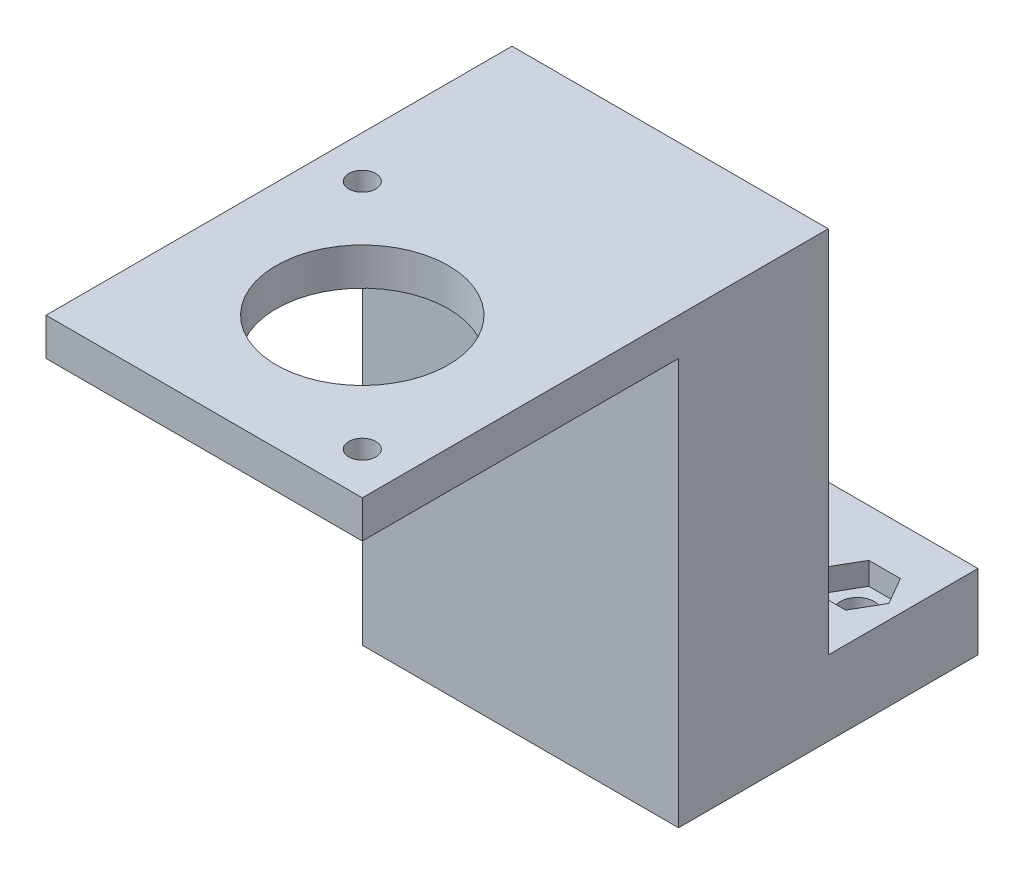
from build123d import *

# Parameters (mm, degrees)
BOSS_EXTRUDE1_DEPTH = 42.25
SKETCH3_R           = 2.25
CUT_EXTRUDE1_DEPTH  = 78.46363663
SKETCH4_R           = 11.5
SKETCH4_R_2         = 1.8
CUT_EXTRUDE2_DEPTH  = 81.737940276
SKETCH5_R           = 1.75
CUT_EXTRUDE3_DEPTH  = 96.794650164
CUT_EXTRUDE4_DEPTH  = 5
CUT_EXTRUDE5_DEPTH  = 3


with BuildPart() as part:
    # Sketch1 → Boss-Extrude1 (new body)
    with BuildSketch(Plane(origin=(0, 0, 0), x_dir=(0, 0, -1), z_dir=(1, 0, 0))):
        Polygon((0, 0), (40, 0), (40, 10), (20, 10), (20, 59.3), (-42.25, 59.3), (-42.25, 54.3), (0, 54.3), align=None)
    extrude(amount=BOSS_EXTRUDE1_DEPTH)

    # Sketch3 → Cut-Extrude1 (cut, through all)
    with BuildSketch(Plane(origin=(0, 10, 0), x_dir=(1, 0, 0), z_dir=(0, 1, 0))):
        with Locations(Location((6.125, 30, 0), (0, 0, 270))):
            Circle(SKETCH3_R)
        with Locations(Location((36.125, 30, 0), (0, 0, 270))):
            Circle(SKETCH3_R)
    extrude(amount=-CUT_EXTRUDE1_DEPTH, mode=Mode.SUBTRACT)

    # Sketch4 → Cut-Extrude2 (cut, through all)
    with BuildSketch(Plane.XZ.offset(-54.3)):
        with Locations(Location((21.125, 21.125, 0), (0, 0, 270))):
            Circle(SKETCH4_R)
        with Locations(Location((5.625, 5.625, 0), (0, 0, 270))):
            Circle(SKETCH4_R_2)
        with Locations(Location((36.625, 36.625, 0), (0, 0, 270))):
            Circle(SKETCH4_R_2)
    extrude(amount=-CUT_EXTRUDE2_DEPTH, mode=Mode.SUBTRACT)

    # Sketch5 → Cut-Extrude3 (cut, through all)
    with BuildSketch(Plane(origin=(0, 0, -20), x_dir=(-1, 0, 0), z_dir=(0, 0, -1))):
        with Locations(Location((-21.125, 43.6, 0), (0, 0, 90))):
            Circle(SKETCH5_R)
        with Locations(Location((-21.125, 37.6, 0), (0, 0, 90))):
            Circle(SKETCH5_R)
    extrude(amount=-CUT_EXTRUDE3_DEPTH, mode=Mode.SUBTRACT)

    # Sketch6 → Cut-Extrude4 (cut)
    with BuildSketch(Plane.XY):
        Polygon((19.508419246, 40.8), (19.508419246, 40.4), (17.891838493, 37.6), (19.508419246, 34.8), (22.741580754, 34.8), (24.358161507, 37.6), (22.741580754, 40.4), (22.741580754, 40.8), (24.358161507, 43.6), (22.741580754, 46.4), (19.508419246, 46.4), (17.891838493, 43.6), align=None)
    extrude(amount=-CUT_EXTRUDE4_DEPTH, mode=Mode.SUBTRACT)

    # Sketch7 → Cut-Extrude5 (cut)
    with BuildSketch(Plane(origin=(0, 10, 0), x_dir=(1, 0, 0), z_dir=(0, 1, 0))):
        Polygon((10.339656965, 30), (8.232328483, 33.65), (4.017671517, 33.65), (1.910343035, 30), (4.017671517, 26.35), (8.232328483, 26.35), align=None)
        Polygon((40.339656965, 30), (38.232328483, 33.65), (34.017671517, 33.65), (31.910343035, 30), (34.017671517, 26.35), (38.232328483, 26.35), align=None)
    extrude(amount=-CUT_EXTRUDE5_DEPTH, mode=Mode.SUBTRACT)


solid = part.part
